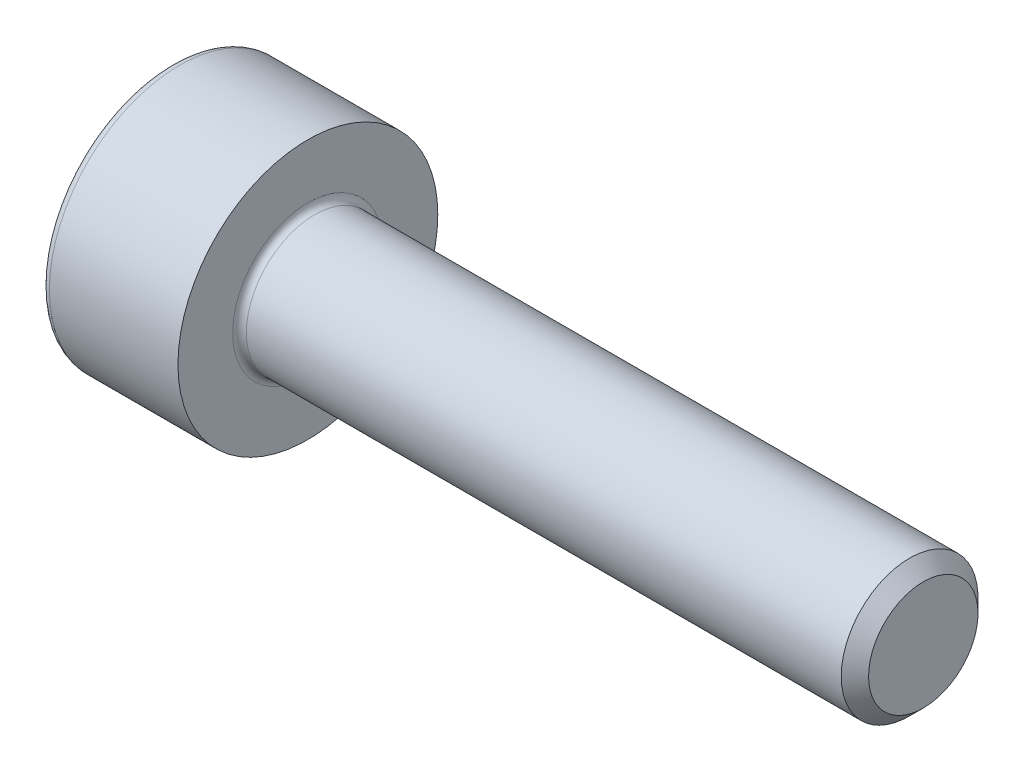
from build123d import *

# Parameters (mm, degrees)
FILLET1_R      = 0.1
FILLET2_R      = 0.12
CHAMFER1_SIZE  = 0.2
EXTRUDE1_DEPTH = 1


with BuildPart() as part:
    # Sketch1 → Revolve1 (revolve)
    with BuildSketch(Plane.XY, mode=Mode.PRIVATE) as revolve1_sk:
        Polygon((2, 1), (2, 0), (4.279914881, 0), (11, 0), (11, 1), align=None)
        Polygon((0, 1.9), (0, 0), (2, 0), (2, 1), (2, 1.9), align=None)
    revolve(revolve1_sk.sketch.rotate(Axis((0, 0, 0), (1, 0, 0)), 90), axis=Axis((0, 0, 0), (1, 0, 0)))

    # Fillet1
    fillet1_edges = [part.edges().sort_by_distance(p)[0] for p in [
        (2, 0, -1),
    ]]
    fillet(fillet1_edges, radius=FILLET1_R)

    # Fillet2
    fillet2_edges = [part.edges().sort_by_distance(p)[0] for p in [
        (0, 0, -1.9),
    ]]
    fillet(fillet2_edges, radius=FILLET2_R)

    # Chamfer1
    chamfer1_edges = [part.edges().sort_by_distance(p)[0] for p in [
        (11, 0, -1),
    ]]
    chamfer(chamfer1_edges, length=CHAMFER1_SIZE)

    # Sketch2 → Extrude1 (cut)
    with BuildSketch(Plane.ZY):
        Polygon((0, 0.866025404), (-0.75, 0.433012702), (-0.75, -0.433012702), (0, -0.866025404), (0.75, -0.433012702), (0.75, 0.433012702), align=None)
    extrude(amount=-EXTRUDE1_DEPTH, mode=Mode.SUBTRACT)


solid = part.part
